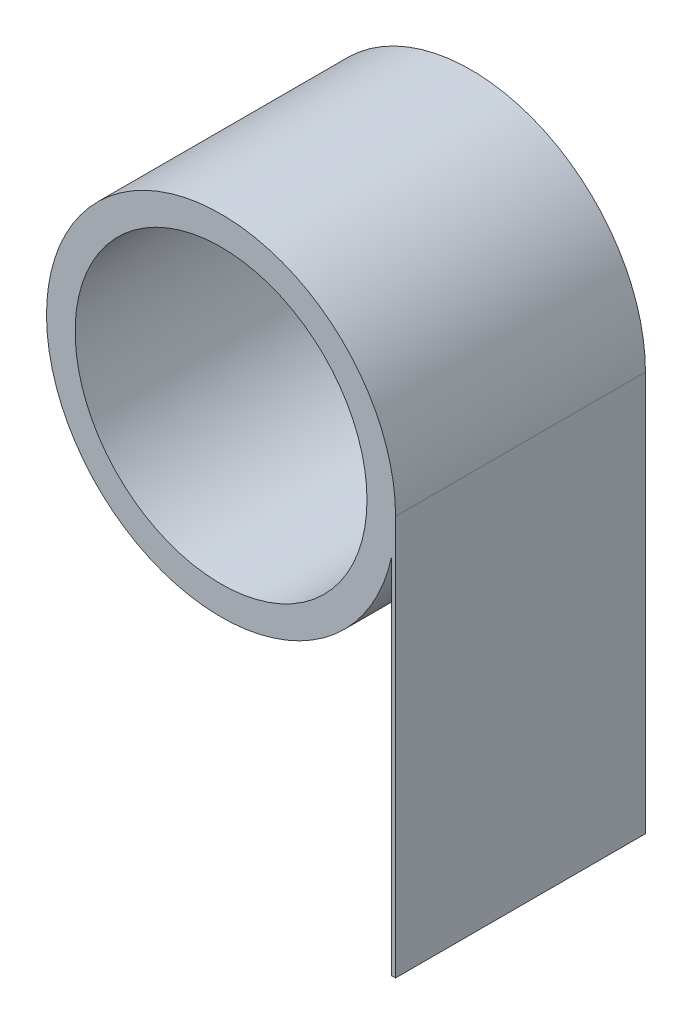
from build123d import *

# Parameters (mm, degrees)
SKETCH1_R           = 11.0871
SKETCH1_R_2         = 9.271
BOSS_EXTRUDE1_DEPTH = 15.875
BOSS_EXTRUDE2_START = -15.875
BOSS_EXTRUDE2_DEPTH = 15.875


with BuildPart() as part:
    # Sketch1 → Boss-Extrude1 (new body)
    with BuildSketch(Plane.XY):
        Circle(SKETCH1_R)
        Circle(SKETCH1_R_2, mode=Mode.SUBTRACT)
    extrude(amount=BOSS_EXTRUDE1_DEPTH)

    # Sketch2 → Boss-Extrude2 (add)
    with BuildSketch(Plane.XY.offset(15.875).offset(BOSS_EXTRUDE2_START)):
        with BuildLine():
            Line((11.0871, 0), (11.0871, -25.4))
            Line((11.0871, -25.4), (10.8331, -25.4))
            Line((10.8331, -25.4), (10.8331, -2.35960395))
            ThreePointArc((10.8331, -2.35960395), (11.023417107, -1.186617756), (11.0871, 0))
        make_face()
    extrude(amount=BOSS_EXTRUDE2_DEPTH)


solid = part.part
